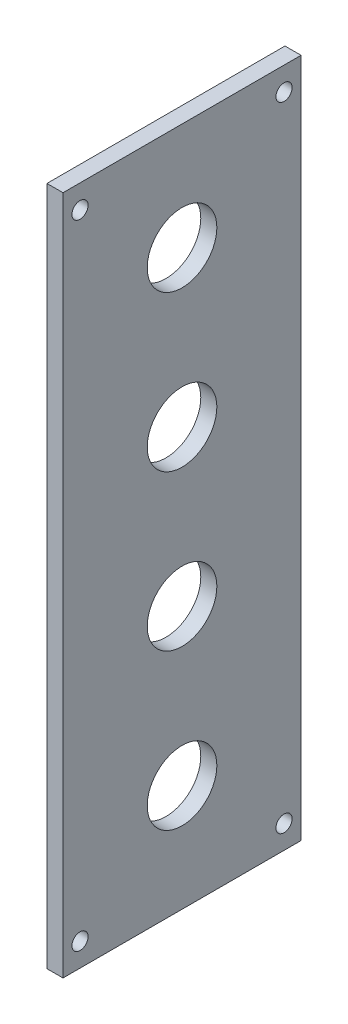
from build123d import *

# Parameters (mm, degrees)
SKETCH1_W              = 254
SKETCH1_H              = 88.9
BOSS_EXTRUDE1_DEPTH    = 6
F_10_CLEARANCE_HOLE1_D = 6.0452
M22_CLEARANCE_HOLE1_D  = 26


with BuildPart() as part:
    # Sketch1 → Boss-Extrude1 (new body)
    with BuildSketch(Plane.YZ):
        Rectangle(SKETCH1_W, SKETCH1_H)
    extrude(amount=-BOSS_EXTRUDE1_DEPTH)

    # #10 Clearance Hole1 (through all)
    with Locations(Plane.YZ):
        with Locations((118.2625, 38.1), (-118.2625, 38.1), (-118.2625, -38.1), (118.2625, -38.1)):
            Hole(F_10_CLEARANCE_HOLE1_D / 2)

    # M22 Clearance Hole1 (through all)
    with Locations(Plane.YZ):
        with Locations((87, 0), (29, 0), (-29, 0), (-87, 0)):
            Hole(M22_CLEARANCE_HOLE1_D / 2)


solid = part.part
